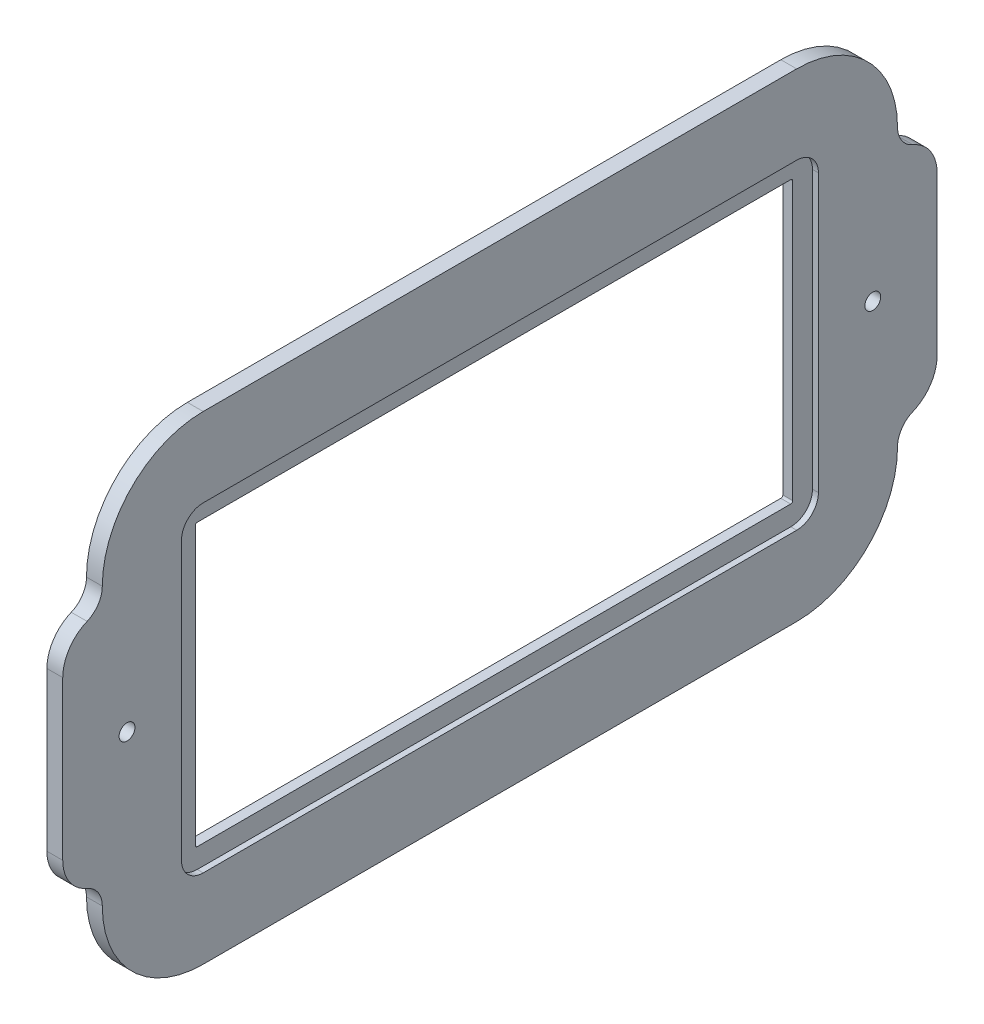
from build123d import *

# Parameters (mm, degrees)
BOSS_EXTRUDE1_DEPTH = 8
CUT_EXTRUDE2_DEPTH  = 3
SKETCH3_R           = 4
CUT_EXTRUDE1_DEPTH  = 235.746671968
BOSS_EXTRUDE2_DEPTH = 8


with BuildPart() as part:
    # Sweep1: sweep along a path in Sketch2
    with BuildLine(Plane(origin=(0, 0, 0), x_dir=(0, 0, -1), z_dir=(1, 0, 0))) as sweep1_path:
        Line((150, 92), (-150, 92))
        ThreePointArc((-150, 92), (-165.556349186, 85.556349186), (-172, 70))
        Line((-172, 70), (-172, -70))
        ThreePointArc((-172, -70), (-165.556349186, -85.556349186), (-150, -92))
        Line((-150, -92), (150, -92))
        ThreePointArc((150, -92), (165.556349186, -85.556349186), (172, -70))
        Line((172, -70), (172, 70))
        ThreePointArc((172, 70), (165.556349186, 85.556349186), (150, 92))
    # Sketch1 → Sweep1 (sweep)
    with BuildSketch(Plane.XY):
        Polygon((-3, 121), (-3, 81), (-6, 81), (-6, 71), (-11, 71), (-11, 121), align=None)
    sweep(path=sweep1_path.line)

    # Sketch5 → Boss-Extrude1 (add)
    with BuildSketch(Plane.ZY.offset(11)):
        with BuildLine():
            Line((201, -70), (201, 70))
            ThreePointArc((201, 70), (186.062445841, 106.062445841), (150, 121))
            Line((150, 121), (-150, 121))
            ThreePointArc((-150, 121), (-186.062445841, 106.062445841), (-201, 70))
            Line((-201, 70), (-201, -70))
            ThreePointArc((-201, -70), (-186.062445841, -106.062445841), (-150, -121))
            Line((-150, -121), (150, -121))
            ThreePointArc((150, -121), (186.062445841, -106.062445841), (201, -70))
        make_face()
        with BuildLine():
            Line((0, 71), (-150, 71))
            ThreePointArc((-150, 71), (-150.707106781, 70.707106781), (-151, 70))
            Line((-151, 70), (-151, -70))
            ThreePointArc((-151, -70), (-150.707106781, -70.707106781), (-150, -71))
            Line((-150, -71), (150, -71))
            ThreePointArc((150, -71), (150.707106781, -70.707106781), (151, -70))
            Line((151, -70), (151, 70))
            ThreePointArc((151, 70), (150.707106781, 70.707106781), (150, 71))
            Line((150, 71), (0, 71))
        make_face(mode=Mode.SUBTRACT)
    extrude(amount=-BOSS_EXTRUDE1_DEPTH)

    # Sketch7 → Cut-Extrude2 (cut)
    with BuildSketch(Plane(origin=(-3, 0, 0), x_dir=(0, 0, -1), z_dir=(1, 0, 0))):
        with BuildLine():
            Line((161, -70), (161, 70))
            ThreePointArc((161, 70), (157.778174593, 77.778174593), (150, 81))
            Line((150, 81), (-150, 81))
            ThreePointArc((-150, 81), (-157.778174593, 77.778174593), (-161, 70))
            Line((-161, 70), (-161, -70))
            ThreePointArc((-161, -70), (-157.778174593, -77.778174593), (-150, -81))
            Line((-150, -81), (150, -81))
            ThreePointArc((150, -81), (157.778174593, -77.778174593), (161, -70))
        make_face()
    extrude(amount=-CUT_EXTRUDE2_DEPTH, mode=Mode.SUBTRACT)

    # Sketch3 → Cut-Extrude1 (cut, through all)
    with BuildSketch(Plane(origin=(-3, 0, 0), x_dir=(0, 0, -1), z_dir=(1, 0, 0))):
        with Locations((-188.5, 0)):
            Circle(SKETCH3_R)
        with Locations(Location((188.5, 0, 0), (0, 0, 180))):
            Circle(SKETCH3_R)
    extrude(amount=-CUT_EXTRUDE1_DEPTH, mode=Mode.SUBTRACT)

    # Sketch8 → Boss-Extrude2 (add)
    with BuildSketch(Plane(origin=(-3, 0, 0), x_dir=(0, 0, -1), z_dir=(1, 0, 0))):
        with BuildLine():
            Line((-201, -70), (-201, 70))
            ThreePointArc((-201, 70), (-203.099371321, 63.066247547), (-208.692307692, 58.461538462))
            ThreePointArc((-208.692307692, 58.461538462), (-217.641005887, 51.094003925), (-221, 40))
            Line((-221, 40), (-221, -40))
            ThreePointArc((-221, -40), (-217.641005887, -51.094003925), (-208.692307692, -58.461538462))
            ThreePointArc((-208.692307692, -58.461538462), (-203.099371321, -63.066247547), (-201, -70))
        make_face()
    boss_extrude2 = extrude(amount=-BOSS_EXTRUDE2_DEPTH)

    # Mirror1: Boss-Extrude2 across plane
    add(boss_extrude2.mirror(Plane.XY))


solid = part.part
